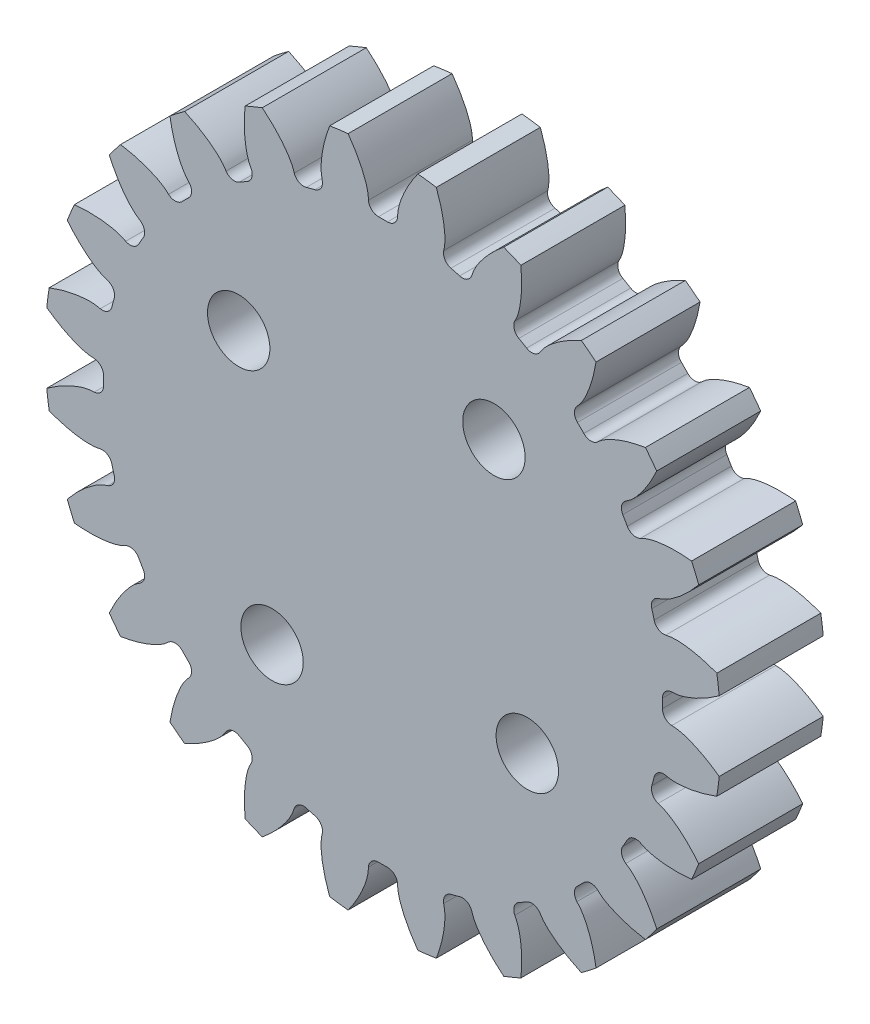
from build123d import *

# Parameters (mm, degrees)
SKETCH_1_R             = 13
LASHENA_DEPTH          = 4
CUT_EXTRUDEA_DEPTH     = 30
WWW_KYTOOL_CN_COUNT    = 24
SKETCH_3_R             = 10.375
CUT_EXTRUDE_2_DEPTH    = 2
HOLE_WIZARD_M2_2_D     = 2.4
HOLE_WIZARD_M2_2_DEPTH = 4


with BuildPart() as part:
    # 草图1 → LaShenA (new body)
    with BuildSketch(Plane.XY):
        Circle(SKETCH_1_R)
    extrude(amount=LASHENA_DEPTH)

    # SketchA → Cut-ExtrudeA (cut)
    with BuildSketch(Plane.XY.offset(4)):
        with BuildLine():
            ThreePointArc((0.173196471, 10.748604699), (0, 10.75), (-0.173196471, 10.748604699))
            ThreePointArc((-0.173196471, 10.748604699), (-0.437444919, 10.849681053), (-0.558609121, 11.105342759))
            add(Edge.make_bspline(
                [(-0.558609121, 11.105342759), (-0.561820005, 11.157808071), (-0.566676225, 11.241465147), (-0.579520194, 11.338853193), (-0.591720059, 11.399886775), (-0.602526477, 11.448246148), (-0.616487252, 11.503691621), (-0.63391432, 11.566103122), (-0.655198403, 11.635327615), (-0.680697435, 11.711203529), (-0.710772051, 11.793553084), (-0.745773672, 11.882184991), (-0.786047574, 11.976893898), (-0.831931307, 12.077460861), (-0.883754559, 12.183653528), (-0.941838585, 12.295226429), (-1.006495777, 12.411921251), (-1.078029212, 12.533467138), (-1.15673221, 12.659581005), (-1.2428879, 12.789967867), (-1.336768835, 12.924321173), (-1.438636448, 13.062323173), (-1.58856632, 13.254761753), (-1.709157908, 13.397453874), (-1.793555093, 13.492413967)],
                knots=[0.11976657, 0.11976657, 0.11976657, 0.11976657, 0.170317048, 0.200987551, 0.214488531, 0.230444233, 0.248854659, 0.269719807, 0.29303968, 0.318814275, 0.347043594, 0.377727635, 0.410866401, 0.446459889, 0.484508101, 0.525011036, 0.567968694, 0.613381076, 0.661248181, 0.711570009, 0.764346561, 0.819577836, 0.877263834, 1, 1, 1, 1], degree=3))
            ThreePointArc((-1.793555093, 13.492413967), (0, 13.611101151), (1.793555093, 13.492413967))
            add(Edge.make_bspline(
                [(0.558609121, 11.105342759), (0.561820005, 11.157808071), (0.566676225, 11.241465147), (0.579520194, 11.338853193), (0.591720059, 11.399886775), (0.602526477, 11.448246148), (0.616487252, 11.503691621), (0.63391432, 11.566103122), (0.655198403, 11.635327615), (0.680697435, 11.711203529), (0.710772051, 11.793553084), (0.745773672, 11.882184991), (0.786047574, 11.976893898), (0.831931307, 12.077460861), (0.883754559, 12.183653528), (0.941838585, 12.295226429), (1.006495777, 12.411921251), (1.078029212, 12.533467138), (1.15673221, 12.659581005), (1.2428879, 12.789967867), (1.336768835, 12.924321173), (1.438636448, 13.062323173), (1.58856632, 13.254761753), (1.709157908, 13.397453874), (1.793555093, 13.492413967)],
                knots=[0.11976657, 0.11976657, 0.11976657, 0.11976657, 0.170317048, 0.200987551, 0.214488531, 0.230444233, 0.248854659, 0.269719807, 0.29303968, 0.318814275, 0.347043594, 0.377727635, 0.410866401, 0.446459889, 0.484508101, 0.525011036, 0.567968694, 0.613381076, 0.661248181, 0.711570009, 0.764346561, 0.819577836, 0.877263834, 1, 1, 1, 1], degree=3))
            ThreePointArc((0.558609121, 11.105342759), (0.437444919, 10.849681053), (0.173196471, 10.748604699))
        make_face()
    cut_extrudea = extrude(amount=-CUT_EXTRUDEA_DEPTH, mode=Mode.SUBTRACT)

    # www.KYTool.cn: Cut-ExtrudeA ×24 about axis
    www_kytool_cn_axis = Axis((0, 0, -88.99), (0, 0, 1))
    for i in range(1, WWW_KYTOOL_CN_COUNT):
        add(cut_extrudea.rotate(www_kytool_cn_axis, i * 360 / WWW_KYTOOL_CN_COUNT), mode=Mode.SUBTRACT)

    # 草图3 → 切除-拉伸2 (cut)
    with BuildSketch(Plane(origin=(0, 0, 0), x_dir=(-1, 0, 0), z_dir=(0, 0, -1))):
        Circle(SKETCH_3_R)
    extrude(amount=-CUT_EXTRUDE_2_DEPTH, mode=Mode.SUBTRACT)

    # M2 间隙孔2
    with Locations(Plane.XY.offset(4)):
        with Locations((195.436640076, 197.494543198), (-5.549494935, 4.26650981), (4.26650981, 5.549494935), (-4.26650981, -5.549494935), (5.549494935, -4.26650981)):
            Hole(HOLE_WIZARD_M2_2_D / 2, depth=HOLE_WIZARD_M2_2_DEPTH)


solid = part.part
